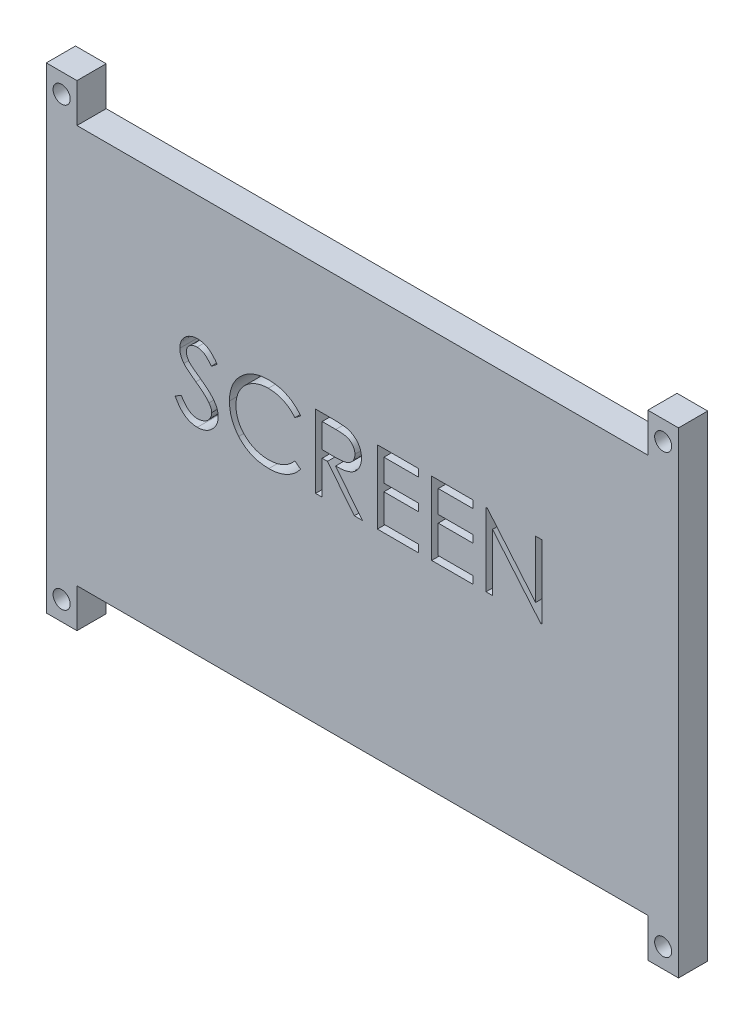
from build123d import *

# Parameters (mm, degrees)
SKETCH1_W           = 164.9
SKETCH1_H           = 124.27
BOSS_EXTRUDE1_DEPTH = 7.62
CUT_EXTRUDE1_DEPTH  = 167.977554509
SKETCH3_W           = 148.9
SKETCH3_H           = 10.155
CUT_EXTRUDE2_DEPTH  = 167.977554653
CUT_EXTRUDE3_DEPTH  = 167.977554653


with BuildPart() as part:
    # Sketch1 → Boss-Extrude1 (new body)
    with BuildSketch(Plane.XY):
        with Locations((-51.841635996, 36.805364924)):
            Rectangle(SKETCH1_W, SKETCH1_H)
    extrude(amount=BOSS_EXTRUDE1_DEPTH)

    # Sketch2 → Cut-Extrude1 (cut, through all)
    # profile 1 of 6: a face of its own
    with BuildSketch(Plane.XY.offset(7.62)):
        with BuildLine():
            Line((-100.687789842, 40.48027478), (-99.077393207, 41.44574954))
            add(Edge.make_bspline(
                [(-99.077393207, 41.44574954), (-98.927615373, 41.195027673), (-98.640646823, 40.714654252), (-98.16194014, 40.065549775), (-97.665916723, 39.513850036), (-97.148903351, 39.062764501), (-96.614055833, 38.707624131), (-96.057882626, 38.456151984), (-95.482257971, 38.299310747), (-95.090514742, 38.280260276), (-94.894941284, 38.27074954)],
                knots=[0, 0, 0, 0, 1.272034388, 2.437168799, 3.508375237, 4.49857839, 5.41946034, 6.295179144, 7.148887113, 8, 8, 8, 8], degree=3))
            add(Edge.make_bspline(
                [(-94.894941284, 38.27074954), (-94.727917086, 38.2754014), (-94.396791222, 38.284623724), (-93.909316728, 38.373237804), (-93.435887204, 38.509375248), (-92.98626019, 38.704343461), (-92.566639774, 38.940228648), (-92.198666189, 39.225141414), (-91.880552345, 39.544126619), (-91.620334164, 39.899995068), (-91.420689972, 40.282721263), (-91.267244571, 40.675564655), (-91.18209067, 41.084696434), (-91.169263198, 41.360161953), (-91.162789842, 41.49917502)],
                knots=[0, 0, 0, 0, 1.095163259, 2.171163733, 3.241058638, 4.321873601, 5.38011039, 6.391990106, 7.366004449, 8.327778327, 9.272591725, 10.192022065, 11.087607919, 12, 12, 12, 12], degree=3))
            add(Edge.make_bspline(
                [(-91.162789842, 41.49917502), (-91.170814305, 41.657784502), (-91.187126864, 41.980214402), (-91.325002492, 42.455918227), (-91.541896249, 42.92668493), (-91.741990067, 43.217884675), (-91.845872775, 43.369066847)],
                knots=[0, 0, 0, 0, 0.938893495, 1.908633276, 2.914225137, 4, 4, 4, 4], degree=3))
            add(Edge.make_bspline(
                [(-91.845872775, 43.369066847), (-91.931165689, 43.478178844), (-92.110227494, 43.707245834), (-92.418061955, 44.048214901), (-92.779283234, 44.399923724), (-93.181529726, 44.775802306), (-93.63945411, 45.158368742), (-94.138713867, 45.565866083), (-94.692055728, 45.982797524), (-95.080128702, 46.262411059), (-95.280367967, 46.40668704)],
                knots=[0, 0, 0, 0, 0.722233717, 1.516239348, 2.393582979, 3.351407094, 4.387010283, 5.505090956, 6.712668013, 8, 8, 8, 8], degree=3))
            add(Edge.make_bspline(
                [(-95.280367967, 46.40668704), (-95.480795718, 46.549445495), (-95.863998315, 46.822388791), (-96.399894313, 47.227469537), (-96.879107747, 47.597822598), (-97.29950868, 47.936934436), (-97.6609122, 48.244851041), (-97.966166194, 48.518615539), (-98.207494626, 48.765631777), (-98.34169143, 48.925876794), (-98.401942486, 48.997822857)],
                knots=[0, 0, 0, 0, 1.452282411, 2.77665338, 3.964542531, 5.026858415, 5.96415736, 6.766646006, 7.446254459, 8, 8, 8, 8], degree=3))
            add(Edge.make_bspline(
                [(-98.401942486, 48.997822857), (-98.48615734, 49.109951358), (-98.651777151, 49.330467102), (-98.870394981, 49.675135257), (-99.056209567, 50.02795903), (-99.201873117, 50.389886521), (-99.324534537, 50.755836634), (-99.407036989, 51.130584129), (-99.458697306, 51.512447466), (-99.46398769, 51.769423805), (-99.466635996, 51.898063242)],
                knots=[0, 0, 0, 0, 1.068054152, 2.10047183, 3.106115577, 4.101338837, 5.06977816, 6.043150881, 7.020423561, 8, 8, 8, 8], degree=3))
            add(Edge.make_bspline(
                [(-99.466635996, 51.898063242), (-99.45953193, 52.099611015), (-99.445475642, 52.498398619), (-99.326600827, 53.080952139), (-99.138969791, 53.637138209), (-98.876107616, 54.161450454), (-98.537249738, 54.640236722), (-98.145113792, 55.079004415), (-97.678054131, 55.447859127), (-97.165594853, 55.770141902), (-96.604673742, 56.022396152), (-96.016894682, 56.212683773), (-95.401323476, 56.320502732), (-94.984383557, 56.335975496), (-94.7728259, 56.343826463)],
                knots=[0, 0, 0, 0, 1.005424448, 1.989358655, 2.955360095, 3.929531133, 4.905563448, 5.876582895, 6.856512386, 7.866279853, 8.892233794, 9.918561126, 10.94386622, 12, 12, 12, 12], degree=3))
            add(Edge.make_bspline(
                [(-94.7728259, 56.343826463), (-94.548340154, 56.336083718), (-94.101909654, 56.320685869), (-93.445233209, 56.18680502), (-92.812987024, 55.965277078), (-92.304388683, 55.713878811), (-91.906337509, 55.462792105), (-91.602774493, 55.234084204), (-91.295158082, 54.970785399), (-90.981006955, 54.67219436), (-90.665644223, 54.335571329), (-90.344388005, 53.963221722), (-90.016487056, 53.557421039), (-89.805544446, 53.267727685), (-89.697405227, 53.119217088)],
                knots=[0, 0, 0, 0, 1.286793592, 2.559021753, 3.825965368, 5.121522368, 5.803751409, 6.523245864, 7.299691795, 8.125521123, 9.008227632, 9.944561021, 10.946284179, 12, 12, 12, 12], degree=3))
            Line((-89.697405227, 53.119217088), (-91.242928063, 51.947672617))
            add(Edge.make_bspline(
                [(-91.242928063, 51.947672617), (-91.336250924, 52.067898203), (-91.515968935, 52.299424573), (-91.788816571, 52.623662733), (-92.045984211, 52.919843858), (-92.299351387, 53.177101197), (-92.535536724, 53.409522809), (-92.764773769, 53.608512342), (-92.983763595, 53.776019512), (-93.259808494, 53.954782317), (-93.606614932, 54.131982715), (-94.041959337, 54.281928411), (-94.496907491, 54.372035248), (-94.806767342, 54.38394905), (-94.963631188, 54.389980309)],
                knots=[0, 0, 0, 0, 1.181633172, 2.275549214, 3.290209073, 4.226197932, 5.078386478, 5.862611352, 6.581680152, 7.217281963, 8.414376989, 9.595101626, 10.782541182, 12, 12, 12, 12], degree=3))
            add(Edge.make_bspline(
                [(-94.963631188, 54.389980309), (-95.160425974, 54.383385199), (-95.539926181, 54.370667151), (-96.078715895, 54.231765517), (-96.563641401, 54.013061392), (-96.980306077, 53.706547011), (-97.327217337, 53.343394179), (-97.578162763, 52.92549784), (-97.729202944, 52.464039334), (-97.747633981, 52.142139747), (-97.757020611, 51.978201463)],
                knots=[0, 0, 0, 0, 1.14458467, 2.207223713, 3.21896685, 4.227309161, 5.202851033, 6.127160689, 7.046193047, 8, 8, 8, 8], degree=3))
            add(Edge.make_bspline(
                [(-97.757020611, 51.978201463), (-97.754880879, 51.876139844), (-97.750597916, 51.671849715), (-97.69086366, 51.370035547), (-97.614123027, 51.068983828), (-97.492515274, 50.770048056), (-97.324628693, 50.468000187), (-97.104164807, 50.157639016), (-96.826506637, 49.836229002), (-96.613816041, 49.627183153), (-96.501521813, 49.516813242)],
                knots=[0, 0, 0, 0, 0.858281714, 1.717966888, 2.583508476, 3.4729293, 4.427298488, 5.488583878, 6.674047936, 8, 8, 8, 8], degree=3))
            add(Edge.make_bspline(
                [(-96.501521813, 49.516813242), (-96.459822058, 49.479600287), (-96.360752984, 49.391190824), (-96.179636874, 49.24645284), (-95.9404625, 49.067912036), (-95.649475377, 48.847001071), (-95.301310165, 48.590743398), (-94.895928581, 48.302415595), (-94.437849381, 47.972657597), (-94.112791524, 47.742111554), (-93.940914842, 47.620208674)],
                knots=[0, 0, 0, 0, 0.420754252, 0.999615792, 1.744751191, 2.668019286, 3.750313428, 4.999500688, 6.413464383, 8, 8, 8, 8], degree=3))
            add(Edge.make_bspline(
                [(-93.940914842, 47.620208674), (-93.734162943, 47.469760703), (-93.333816544, 47.178439058), (-92.764180288, 46.740748), (-92.247686847, 46.312679431), (-91.782522839, 45.896967027), (-91.364092808, 45.49676412), (-90.997038929, 45.107255953), (-90.677621154, 44.73123305), (-90.333745694, 44.249145174), (-89.982366705, 43.657065273), (-89.6806065, 42.93165086), (-89.490333209, 42.203416601), (-89.465451103, 41.713957677), (-89.453174457, 41.47246228)],
                knots=[0, 0, 0, 0, 1.163667725, 2.253281268, 3.268753668, 4.215851969, 5.092017293, 5.902905408, 6.650798638, 7.335211899, 8.59617414, 9.77448103, 10.901945474, 12, 12, 12, 12], degree=3))
            add(Edge.make_bspline(
                [(-89.453174457, 41.47246228), (-89.456751166, 41.301674321), (-89.463835127, 40.963414991), (-89.545265243, 40.466726644), (-89.66457085, 39.984321482), (-89.844387794, 39.522162427), (-90.063860984, 39.071794504), (-90.342351562, 38.645031504), (-90.665154817, 38.232428106), (-91.035452881, 37.844986531), (-91.440651292, 37.489316522), (-91.868915401, 37.172928344), (-92.320946173, 36.909122184), (-92.794291411, 36.693852601), (-93.289059843, 36.525485884), (-93.805085067, 36.403495839), (-94.343217692, 36.32862547), (-94.708980313, 36.320854368), (-94.894941284, 36.316903386)],
                knots=[0, 0, 0, 0, 0.983748083, 1.948392443, 2.894712957, 3.844097841, 4.80183111, 5.778335162, 6.776009319, 7.81870978, 8.863265674, 9.881300176, 10.883814829, 11.87499822, 12.874611388, 13.892143829, 14.928324115, 16, 16, 16, 16], degree=3))
            add(Edge.make_bspline(
                [(-94.894941284, 36.316903386), (-95.03882508, 36.319685674), (-95.324780602, 36.325215211), (-95.747742211, 36.374099037), (-96.162159118, 36.443261987), (-96.562831139, 36.553066568), (-96.954920479, 36.686291257), (-97.336721856, 36.850329896), (-97.708420306, 37.046910664), (-98.072098864, 37.271673584), (-98.426832586, 37.533245022), (-98.769294261, 37.837900767), (-99.110720257, 38.177238444), (-99.441033085, 38.560473082), (-99.766914056, 38.981413218), (-100.081937971, 39.443997202), (-100.392625606, 39.945705371), (-100.587564081, 40.298756766), (-100.687789842, 40.48027478)],
                knots=[0, 0, 0, 0, 0.915332311, 1.819136955, 2.706846663, 3.586547465, 4.459518054, 5.340707479, 6.227863349, 7.133153174, 8.059268498, 9.028702269, 10.047606654, 11.120612155, 12.245963614, 13.433783089, 14.680604001, 16, 16, 16, 16], degree=3))
        make_face()
    # profile 2 of 6: a face of its own
    with BuildSketch(Plane.XY.offset(7.62)):
        with BuildLine():
            Line((-67.960866765, 52.35981204), (-69.456780227, 51.214980309))
            add(Edge.make_bspline(
                [(-69.456780227, 51.214980309), (-69.563492276, 51.342157945), (-69.775477665, 51.594798586), (-70.116522753, 51.949561535), (-70.471950267, 52.281931029), (-70.841624341, 52.593490403), (-71.232198977, 52.873344514), (-71.634212753, 53.136077231), (-72.054390684, 53.371577348), (-72.635425126, 53.657125886), (-73.395508414, 53.955101387), (-74.35233461, 54.204946117), (-75.351159303, 54.363992802), (-76.032591952, 54.381218582), (-76.379196092, 54.389980309)],
                knots=[0, 0, 0, 0, 0.757959112, 1.505699292, 2.245454638, 2.979532153, 3.711538275, 4.438200793, 5.171680507, 5.909471876, 7.393775596, 8.890124382, 10.418191784, 12, 12, 12, 12], degree=3))
            add(Edge.make_bspline(
                [(-76.379196092, 54.389980309), (-76.570149479, 54.387781599), (-76.950284024, 54.383404584), (-77.514427858, 54.325660631), (-78.068037465, 54.244501045), (-78.610752731, 54.124076072), (-79.141882834, 53.971825102), (-79.664900051, 53.789895349), (-80.17223203, 53.564806864), (-80.670897012, 53.316023335), (-81.148666718, 53.035022528), (-81.600723478, 52.728516999), (-82.02541856, 52.399936631), (-82.423087921, 52.048049895), (-82.794138097, 51.67444151), (-83.13588046, 51.275129879), (-83.447132478, 50.85139162), (-83.734063715, 50.408814359), (-83.991035878, 49.948687236), (-84.206191364, 49.46930721), (-84.396719244, 48.978883449), (-84.547482264, 48.471874988), (-84.666814277, 47.951849363), (-84.749151987, 47.417410931), (-84.806239238, 46.869676189), (-84.810594486, 46.498422645), (-84.812789842, 46.311284395)],
                knots=[0, 0, 0, 0, 1.054917814, 2.100044995, 3.131103042, 4.146048494, 5.169673617, 6.183595914, 7.203665975, 8.234915748, 9.262203917, 10.264457458, 11.251630812, 12.227803204, 13.197192746, 14.159520551, 15.12972552, 16.100847026, 17.073214652, 18.039054194, 19.002613845, 19.979014051, 20.95965708, 21.949030935, 22.966165397, 24, 24, 24, 24], degree=3))
            add(Edge.make_bspline(
                [(-84.812789842, 46.311284395), (-84.805921941, 46.029718211), (-84.792437729, 45.476900357), (-84.672431797, 44.667163176), (-84.490068371, 43.891443509), (-84.21675216, 43.154590367), (-83.879735613, 42.447517733), (-83.453883142, 41.782189116), (-82.960670274, 41.148550387), (-82.393119505, 40.561576628), (-81.770424993, 40.025380495), (-81.102325645, 39.553209473), (-80.39048545, 39.159609898), (-79.642764078, 38.832080818), (-78.853407657, 38.580312057), (-78.023835661, 38.403070185), (-77.155852373, 38.287452031), (-76.562747496, 38.276382957), (-76.260896813, 38.27074954)],
                knots=[0, 0, 0, 0, 1.029171465, 2.020641659, 2.987623507, 3.938342917, 4.889210282, 5.84687017, 6.821220943, 7.821438502, 8.827599549, 9.822697543, 10.807740252, 11.797342354, 12.80366471, 13.83203677, 14.896651826, 16, 16, 16, 16], degree=3))
            add(Edge.make_bspline(
                [(-76.260896813, 38.27074954), (-75.928323606, 38.279941327), (-75.273739976, 38.298032962), (-74.313794004, 38.451299732), (-73.394845051, 38.699809257), (-72.516843687, 39.047596519), (-71.682265113, 39.499709015), (-70.88980329, 40.047793176), (-70.138789314, 40.69706253), (-69.687188478, 41.192814986), (-69.456780227, 41.44574954)],
                knots=[0, 0, 0, 0, 1.028121516, 2.023589091, 2.998037872, 3.967518031, 4.937445131, 5.927275754, 6.942489185, 8, 8, 8, 8], degree=3))
            Line((-69.456780227, 41.44574954), (-67.960866765, 40.312366126))
            add(Edge.make_bspline(
                [(-67.960866765, 40.312366126), (-68.081252478, 40.157035409), (-68.321447261, 39.847118001), (-68.71038304, 39.410210552), (-69.120106615, 38.999252873), (-69.553661266, 38.617558249), (-70.006059531, 38.257488944), (-70.485424546, 37.92927469), (-70.985454565, 37.628334306), (-71.504455372, 37.352779188), (-72.041875536, 37.108301029), (-72.597071103, 36.899002665), (-73.16764895, 36.718708623), (-73.75363516, 36.570380225), (-74.356245208, 36.454604754), (-74.973304503, 36.377209095), (-75.606144823, 36.324185247), (-76.033090273, 36.319352448), (-76.249448496, 36.316903386)],
                knots=[0, 0, 0, 0, 0.986787822, 1.968848986, 2.935600012, 3.899624008, 4.868462664, 5.837806735, 6.815139263, 7.798259679, 8.787526145, 9.778297419, 10.776456485, 11.791383307, 12.812564526, 13.85620153, 14.913611965, 16, 16, 16, 16], degree=3))
            add(Edge.make_bspline(
                [(-76.249448496, 36.316903386), (-76.454337598, 36.318329374), (-76.859480426, 36.321149089), (-77.457643631, 36.366826457), (-78.039972635, 36.429145739), (-78.604803099, 36.52298131), (-79.155217334, 36.633712646), (-79.686225658, 36.7821462), (-80.203053303, 36.94842095), (-80.703623843, 37.143846663), (-81.188363066, 37.364370457), (-81.655707526, 37.61360737), (-82.105442279, 37.88946152), (-82.541988927, 38.185852362), (-82.958898632, 38.512300248), (-83.359784249, 38.864271501), (-83.746893727, 39.240579817), (-83.986394055, 39.511932662), (-84.106810275, 39.648363722)],
                knots=[0, 0, 0, 0, 1.114604814, 2.203992996, 3.262667896, 4.300477797, 5.318619304, 6.316056647, 7.298880507, 8.271930387, 9.238335007, 10.195173496, 11.151986948, 12.108099108, 13.064862484, 14.031167946, 15.010108607, 16, 16, 16, 16], degree=3))
            add(Edge.make_bspline(
                [(-84.106810275, 39.648363722), (-84.29968142, 39.885352193), (-84.683095201, 40.356468003), (-85.173636422, 41.120024558), (-85.593539544, 41.917230095), (-85.933042769, 42.75227285), (-86.19845136, 43.623279058), (-86.382317579, 44.530687786), (-86.501797026, 45.473651586), (-86.515460169, 46.115020393), (-86.522405227, 46.441031992)],
                knots=[0, 0, 0, 0, 0.994628077, 1.977248131, 2.950237994, 3.925870899, 4.908910175, 5.911660606, 6.938484602, 8, 8, 8, 8], degree=3))
            add(Edge.make_bspline(
                [(-86.522405227, 46.441031992), (-86.51394053, 46.783689532), (-86.497286769, 47.45784685), (-86.355795368, 48.44721651), (-86.128181634, 49.395097695), (-85.804892855, 50.299720933), (-85.395016585, 51.165844316), (-84.888686016, 51.986851445), (-84.291783427, 52.767992883), (-83.608990238, 53.497416029), (-82.860230884, 54.16438022), (-82.058395626, 54.751153986), (-81.205053886, 55.239473609), (-80.309606722, 55.647667007), (-79.36534894, 55.961417585), (-78.374295174, 56.181054216), (-77.338307652, 56.317763091), (-76.631485021, 56.335045294), (-76.272345131, 56.343826463)],
                knots=[0, 0, 0, 0, 1.032925535, 2.032216505, 3.007276963, 3.968222605, 4.92396291, 5.891752235, 6.871517503, 7.883894988, 8.900124299, 9.891468569, 10.874487609, 11.85992873, 12.854644235, 13.869047385, 14.917252991, 16, 16, 16, 16], degree=3))
            add(Edge.make_bspline(
                [(-76.272345131, 56.343826463), (-76.053463505, 56.341202253), (-75.620209369, 56.336007895), (-74.979298504, 56.285355893), (-74.355316696, 56.200917551), (-73.747834065, 56.085985799), (-73.153895254, 55.943343093), (-72.578039657, 55.757522326), (-72.016888233, 55.545052063), (-71.473980062, 55.300349555), (-70.951919982, 55.025666291), (-70.450870591, 54.724046969), (-69.97481186, 54.395865513), (-69.520393985, 54.043913087), (-69.095218607, 53.660743786), (-68.687213988, 53.256896871), (-68.310235834, 52.820739913), (-68.077536302, 52.513735916), (-67.960866765, 52.35981204)],
                knots=[0, 0, 0, 0, 1.096760587, 2.17092713, 3.219439832, 4.250915756, 5.268269357, 6.278326846, 7.281116186, 8.274029601, 9.260640565, 10.235837813, 11.203064059, 12.156899882, 13.114053108, 14.069676657, 15.032185724, 16, 16, 16, 16], degree=3))
        make_face()
    # profile 3 of 6: a face of its own
    with BuildSketch(Plane.XY.offset(7.62)):
        with BuildLine():
            Line((-64.053174457, 55.855364924), (-60.240884794, 55.855364924))
            add(Edge.make_bspline(
                [(-60.240884794, 55.855364924), (-59.986479509, 55.854518092), (-59.49799318, 55.85289208), (-58.798187237, 55.843825571), (-58.162314038, 55.817839435), (-57.590706055, 55.795477002), (-57.083373776, 55.754699435), (-56.638761522, 55.715725056), (-56.258917054, 55.664705559), (-56.028978921, 55.617323186), (-55.924869169, 55.595869732)],
                knots=[0, 0, 0, 0, 1.410062039, 2.707475311, 3.878576406, 4.937260626, 5.877586885, 6.699081471, 7.410979367, 8, 8, 8, 8], degree=3))
            add(Edge.make_bspline(
                [(-55.924869169, 55.595869732), (-55.785495972, 55.561434052), (-55.509722786, 55.493297298), (-55.112665998, 55.349281471), (-54.734309464, 55.182623228), (-54.376224848, 54.986877836), (-54.040205756, 54.76059225), (-53.722787522, 54.507672898), (-53.422529786, 54.229503678), (-53.151575484, 53.919071183), (-52.896092931, 53.593389609), (-52.680617693, 53.241216304), (-52.494872139, 52.872944276), (-52.346986896, 52.484828188), (-52.227908212, 52.080631972), (-52.143945395, 51.656694379), (-52.093592502, 51.214946786), (-52.088466117, 50.913641596), (-52.085866765, 50.760863722)],
                knots=[0, 0, 0, 0, 1.027469482, 2.033020251, 3.019912614, 3.986113645, 4.951240523, 5.91722682, 6.890402269, 7.87763091, 8.8651537, 9.85103654, 10.82876324, 11.815024772, 12.821070561, 13.842952187, 14.906261191, 16, 16, 16, 16], degree=3))
            add(Edge.make_bspline(
                [(-52.085866765, 50.760863722), (-52.093862312, 50.50703551), (-52.109463695, 50.011750925), (-52.254924616, 49.292962413), (-52.493193959, 48.622460572), (-52.821525004, 48.001089643), (-53.239642436, 47.440961702), (-53.742153085, 46.948979366), (-54.329337284, 46.537282128), (-54.875959704, 46.251789005), (-55.358818419, 46.068947602), (-55.756328308, 45.940298278), (-56.189944285, 45.84090101), (-56.655511778, 45.75185515), (-57.154968246, 45.684626641), (-57.687116603, 45.63538732), (-58.252336371, 45.604613141), (-58.640624734, 45.600030228), (-58.840373977, 45.597672617)],
                knots=[0, 0, 0, 0, 1.260483769, 2.459530307, 3.627416485, 4.787058657, 5.939039949, 7.08810263, 8.267026773, 9.491475466, 10.141966685, 10.831826277, 11.566392101, 12.351337768, 13.187381173, 14.07005841, 15.007169909, 16, 16, 16, 16], degree=3))
            Line((-58.840373977, 45.597672617), (-51.841635996, 36.805364924))
            Line((-51.841635996, 36.805364924), (-53.955758592, 36.805364924))
            Line((-53.955758592, 36.805364924), (-60.954496573, 45.597672617))
            Line((-60.954496573, 45.597672617), (-62.343559073, 45.597672617))
            Line((-62.343559073, 45.597672617), (-62.343559073, 36.805364924))
            Line((-62.343559073, 36.805364924), (-64.053174457, 36.805364924))
            Line((-64.053174457, 36.805364924), (-64.053174457, 55.855364924))
        make_face()
        with BuildLine():
            Line((-62.343559073, 53.90151877), (-62.343559073, 47.55151877))
            Line((-62.343559073, 47.55151877), (-58.8556384, 47.52480603))
            add(Edge.make_bspline(
                [(-58.8556384, 47.52480603), (-58.692787902, 47.524733985), (-58.377137256, 47.524594341), (-57.920477923, 47.546331894), (-57.495281315, 47.571060526), (-57.103173792, 47.608884821), (-56.74398019, 47.65763144), (-56.417880041, 47.718607683), (-56.124341029, 47.789648196), (-55.78199327, 47.899602759), (-55.399705864, 48.073806944), (-54.984244632, 48.327256301), (-54.630446194, 48.64603965), (-54.331536115, 49.010566603), (-54.091345924, 49.411358186), (-53.922007456, 49.843610139), (-53.814552163, 50.296410122), (-53.801878223, 50.607622395), (-53.79548215, 50.764679828)],
                knots=[0, 0, 0, 0, 1.146690395, 2.22261258, 3.21895312, 4.145990853, 4.996080663, 5.770904154, 6.481378293, 7.121626537, 8.300444488, 9.431385265, 10.535395872, 11.636531494, 12.74115979, 13.810798291, 14.895190096, 16, 16, 16, 16], degree=3))
            add(Edge.make_bspline(
                [(-53.79548215, 50.764679828), (-53.802025123, 50.917877608), (-53.814990909, 51.221459707), (-53.920847778, 51.665901162), (-54.099859982, 52.085365562), (-54.341099591, 52.478146544), (-54.635009277, 52.834684907), (-54.979639086, 53.139741554), (-55.365565934, 53.391470783), (-55.7262706, 53.552331054), (-56.048673956, 53.650954827), (-56.328598249, 53.72035759), (-56.64489072, 53.776116771), (-56.999087145, 53.820792073), (-57.38967545, 53.859191127), (-57.818630565, 53.88505438), (-58.283106469, 53.90036984), (-58.605034766, 53.901126881), (-58.771684073, 53.90151877)],
                knots=[0, 0, 0, 0, 1.101028733, 2.181837193, 3.264309656, 4.369019818, 5.486613113, 6.575447106, 7.666700264, 8.788928104, 9.402425223, 10.0903467, 10.862060571, 11.710948788, 12.657782767, 13.684531032, 14.801375019, 16, 16, 16, 16], degree=3))
            Line((-58.771684073, 53.90151877), (-62.343559073, 53.90151877))
        make_face(mode=Mode.SUBTRACT)
    # profile 4 of 6: a face of its own
    with BuildSketch(Plane.XY.offset(7.62)):
        Polygon((-47.933943688, 55.855364924), (-37.187789842, 55.855364924), (-37.187789842, 53.90151877), (-46.224328304, 53.90151877), (-46.224328304, 48.039980309), (-37.187789842, 48.039980309), (-37.187789842, 46.086134155), (-46.224328304, 46.086134155), (-46.224328304, 38.759211078), (-37.187789842, 38.759211078), (-37.187789842, 36.805364924), (-47.933943688, 36.805364924), align=None)
    # profile 5 of 6: a face of its own
    with BuildSketch(Plane.XY.offset(7.62)):
        Polygon((-33.768559073, 55.855364924), (-23.022405227, 55.855364924), (-23.022405227, 53.90151877), (-32.058943688, 53.90151877), (-32.058943688, 48.039980309), (-23.022405227, 48.039980309), (-23.022405227, 46.086134155), (-32.058943688, 46.086134155), (-32.058943688, 38.759211078), (-23.022405227, 38.759211078), (-23.022405227, 36.805364924), (-33.768559073, 36.805364924), align=None)
    # profile 6 of 6: a face of its own
    with BuildSketch(Plane.XY.offset(7.62)):
        Polygon((-19.603174457, 36.805364924), (-19.603174457, 55.855364924), (-19.244460515, 55.855364924), (-6.658943688, 40.861885357), (-6.658943688, 55.855364924), (-4.949328304, 55.855364924), (-4.949328304, 36.805364924), (-5.338571092, 36.805364924), (-17.893559073, 51.76449954), (-17.893559073, 36.805364924), align=None)
    extrude(amount=-CUT_EXTRUDE1_DEPTH, mode=Mode.SUBTRACT)


with BuildPart() as cut_extrude1_piece_1:
    # of the separate pieces the step leaves, piece 1, a body of its own (cut_extrude1_pieces)
    add(part.part.solids().sort_by_distance((-134.291635996, 98.940364924, 0))[0])

    # Sketch3 → Cut-Extrude2 (cut, through all)
    with BuildSketch(Plane.XY.offset(7.62)):
        with Locations((-51.841635996, -20.252135076)):
            Rectangle(SKETCH3_W, SKETCH3_H)
        with Locations((-51.841635996, 93.862864924)):
            Rectangle(SKETCH3_W, SKETCH3_H)
    extrude(amount=-CUT_EXTRUDE2_DEPTH, mode=Mode.SUBTRACT)

    # Sketch5 → Cut-Extrude3 (cut, through all)
    with BuildSketch(Plane.XY.offset(7.62)):
        with BuildLine():
            ThreePointArc((-132.515157253, -20.252135076), (-131.863902955, -21.824402035), (-130.291635996, -22.475656333))
            Line((-130.291635996, -22.475656333), (-130.291635996, -20.252135076))
            Line((-130.291635996, -20.252135076), (-132.515157253, -20.252135076))
        make_face()
        with BuildLine():
            Line((-130.291635996, -20.252135076), (-130.291635996, -22.475656333))
            ThreePointArc((-130.291635996, -22.475656333), (-128.719369037, -21.824402035), (-128.068114739, -20.252135076))
            Line((-128.068114739, -20.252135076), (-130.291635996, -20.252135076))
        make_face()
        with BuildLine():
            Line((-132.515157253, -20.252135076), (-130.291635996, -20.252135076))
            Line((-130.291635996, -20.252135076), (-130.291635996, -18.028613819))
            ThreePointArc((-130.291635996, -18.028613819), (-131.863902955, -18.679868117), (-132.515157253, -20.252135076))
        make_face()
        with BuildLine():
            Line((-130.291635996, -18.028613819), (-130.291635996, -20.252135076))
            Line((-130.291635996, -20.252135076), (-128.068114739, -20.252135076))
            ThreePointArc((-128.068114739, -20.252135076), (-128.719369037, -18.679868117), (-130.291635996, -18.028613819))
        make_face()
        with BuildLine():
            ThreePointArc((-128.051940744, 93.862864924), (-128.707932295, 95.446568625), (-130.291635996, 96.102560177))
            Line((-130.291635996, 96.102560177), (-130.291635996, 93.862864924))
            Line((-130.291635996, 93.862864924), (-128.051940744, 93.862864924))
        make_face()
        with BuildLine():
            Line((-130.291635996, 93.862864924), (-130.291635996, 96.102560177))
            ThreePointArc((-130.291635996, 96.102560177), (-131.875339697, 95.446568625), (-132.531331248, 93.862864924))
            Line((-132.531331248, 93.862864924), (-130.291635996, 93.862864924))
        make_face()
        with BuildLine():
            Line((-128.051940744, 93.862864924), (-130.291635996, 93.862864924))
            Line((-130.291635996, 93.862864924), (-130.291635996, 91.623169672))
            ThreePointArc((-130.291635996, 91.623169672), (-128.707932295, 92.279161224), (-128.051940744, 93.862864924))
        make_face()
        with BuildLine():
            Line((-130.291635996, 91.623169672), (-130.291635996, 93.862864924))
            Line((-130.291635996, 93.862864924), (-132.531331248, 93.862864924))
            ThreePointArc((-132.531331248, 93.862864924), (-131.875339697, 92.279161224), (-130.291635996, 91.623169672))
        make_face()
        with BuildLine():
            ThreePointArc((28.831773276, 93.862864924), (28.180551777, 95.435052697), (26.608364004, 96.086274196))
            Line((26.608364004, 96.086274196), (26.608364004, 93.862864924))
            Line((26.608364004, 93.862864924), (28.831773276, 93.862864924))
        make_face()
        with BuildLine():
            Line((26.608364004, 93.862864924), (26.608364004, 96.086274196))
            ThreePointArc((26.608364004, 96.086274196), (25.036176231, 95.435052697), (24.384954733, 93.862864924))
            Line((24.384954733, 93.862864924), (26.608364004, 93.862864924))
        make_face()
        with BuildLine():
            Line((28.831773276, 93.862864924), (26.608364004, 93.862864924))
            Line((26.608364004, 93.862864924), (26.608364004, 91.639455653))
            ThreePointArc((26.608364004, 91.639455653), (28.180551777, 92.290677151), (28.831773276, 93.862864924))
        make_face()
        with BuildLine():
            Line((26.608364004, 91.639455653), (26.608364004, 93.862864924))
            Line((26.608364004, 93.862864924), (24.384954733, 93.862864924))
            ThreePointArc((24.384954733, 93.862864924), (25.036176231, 92.290677151), (26.608364004, 91.639455653))
        make_face()
        with BuildLine():
            ThreePointArc((24.386151608, -20.252135076), (25.03702255, -21.82347653), (26.608364004, -22.474347471))
            Line((26.608364004, -22.474347471), (26.608364004, -20.252135076))
            Line((26.608364004, -20.252135076), (24.386151608, -20.252135076))
        make_face()
        with BuildLine():
            Line((26.608364004, -20.252135076), (26.608364004, -22.474347471))
            ThreePointArc((26.608364004, -22.474347471), (28.179705458, -21.82347653), (28.8305764, -20.252135076))
            Line((28.8305764, -20.252135076), (26.608364004, -20.252135076))
        make_face()
        with BuildLine():
            Line((24.386151608, -20.252135076), (26.608364004, -20.252135076))
            Line((26.608364004, -20.252135076), (26.608364004, -18.02992268))
            ThreePointArc((26.608364004, -18.02992268), (25.03702255, -18.680793622), (24.386151608, -20.252135076))
        make_face()
        with BuildLine():
            Line((26.608364004, -18.02992268), (26.608364004, -20.252135076))
            Line((26.608364004, -20.252135076), (28.8305764, -20.252135076))
            ThreePointArc((28.8305764, -20.252135076), (28.179705458, -18.680793622), (26.608364004, -18.02992268))
        make_face()
    extrude(amount=-CUT_EXTRUDE3_DEPTH, mode=Mode.SUBTRACT)


with BuildPart() as cut_extrude1_piece_2:
    # of the separate pieces the step leaves, piece 2, a body of its own (cut_extrude1_pieces)
    add(part.part.solids().sort_by_distance((-58.8556384, 47.52480603, 0))[0])


solid = Compound([cut_extrude1_piece_1.part, cut_extrude1_piece_2.part])
